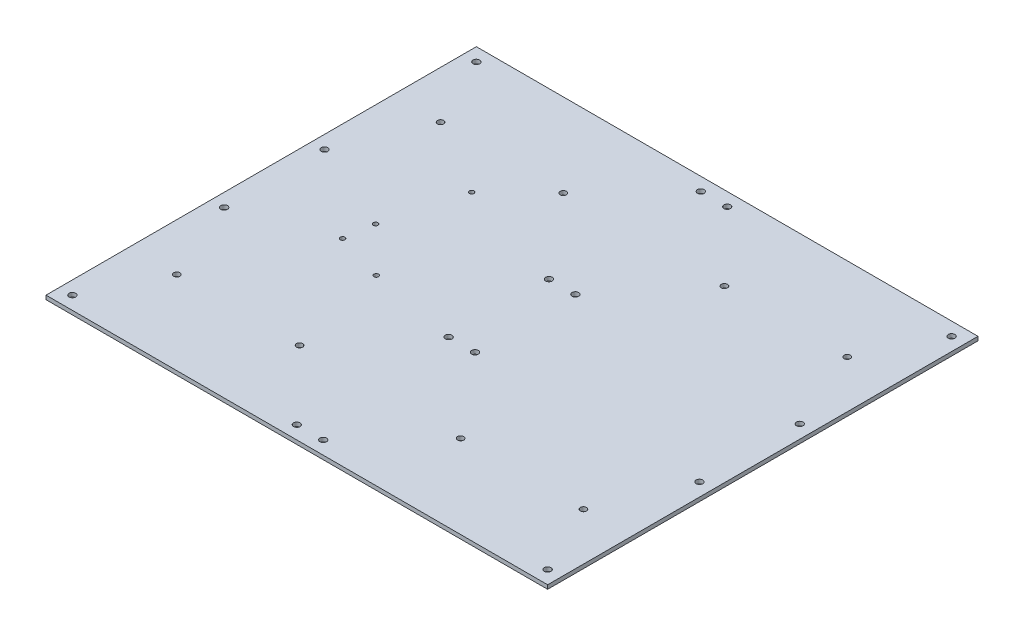
from build123d import *

# Parameters (mm, degrees)
SKIZZE1_W                       = 380
SKIZZE1_H                       = 326
AUFSATZ_LINEAR_AUSTRAGEN1_DEPTH = 3
SKIZZE2_R                       = 2.5
SCHNITT_LINEAR_AUSTRAGEN1_DEPTH = 251.355746888
SKIZZE3_R                       = 2.35
SCHNITT_LINEAR_AUSTRAGEN2_DEPTH = 251.355746888
SKIZZE4_R                       = 1.75
SCHNITT_LINEAR_AUSTRAGEN3_DEPTH = 251.355746888


with BuildPart() as part:
    # Skizze1 → Aufsatz-Linear austragen1 (new body)
    with BuildSketch(Plane(origin=(0, 0, 0), x_dir=(1, 0, 0), z_dir=(0, 1, 0))):
        Rectangle(SKIZZE1_W, SKIZZE1_H)
    extrude(amount=AUFSATZ_LINEAR_AUSTRAGEN1_DEPTH)

    # Skizze2 → Schnitt-Linear austragen1 (cut, through all)
    with BuildSketch(Plane(origin=(0, 3, 0), x_dir=(1, 0, 0), z_dir=(0, 1, 0))):
        with Locations(Location((-180, 153, 0), (0, 0, 270))):
            Circle(SKIZZE2_R)
        with Locations(Location((180, 153, 0), (0, 0, 270))):
            Circle(SKIZZE2_R)
        with Locations(Location((-180, -153, 0), (0, 0, 270))):
            Circle(SKIZZE2_R)
        with Locations(Location((180, -153, 0), (0, 0, 270))):
            Circle(SKIZZE2_R)
        with Locations(Location((-10, 153, 0), (0, 0, 270))):
            Circle(SKIZZE2_R)
        with Locations(Location((10, 153, 0), (0, 0, 270))):
            Circle(SKIZZE2_R)
        with Locations(Location((-10, 38, 0), (0, 0, 270))):
            Circle(SKIZZE2_R)
        with Locations(Location((10, 38, 0), (0, 0, 270))):
            Circle(SKIZZE2_R)
        with Locations(Location((-10, -38, 0), (0, 0, 270))):
            Circle(SKIZZE2_R)
        with Locations(Location((10, -38, 0), (0, 0, 270))):
            Circle(SKIZZE2_R)
        with Locations(Location((-10, -153, 0), (0, 0, 270))):
            Circle(SKIZZE2_R)
        with Locations(Location((10, -153, 0), (0, 0, 270))):
            Circle(SKIZZE2_R)
        with Locations(Location((-180, 38, 0), (0, 0, 270))):
            Circle(SKIZZE2_R)
        with Locations(Location((-180, -38, 0), (0, 0, 270))):
            Circle(SKIZZE2_R)
        with Locations(Location((180, 38, 0), (0, 0, 270))):
            Circle(SKIZZE2_R)
        with Locations(Location((180, -38, 0), (0, 0, 270))):
            Circle(SKIZZE2_R)
    extrude(amount=-SCHNITT_LINEAR_AUSTRAGEN1_DEPTH, mode=Mode.SUBTRACT)

    # Skizze3 → Schnitt-Linear austragen2 (cut, through all)
    with BuildSketch(Plane(origin=(0, 3, 0), x_dir=(1, 0, 0), z_dir=(0, 1, 0))):
        with Locations(Location((61, 99.9, 0), (0, 0, 270))):
            Circle(SKIZZE3_R)
        with Locations(Location((154, 99.9, 0), (0, 0, 270))):
            Circle(SKIZZE3_R)
        with Locations(Location((-154, -99.9, 0), (0, 0, 270))):
            Circle(SKIZZE3_R)
        with Locations(Location((-61, -99.9, 0), (0, 0, 270))):
            Circle(SKIZZE3_R)
        with Locations(Location((154, -99.9, 0), (0, 0, 270))):
            Circle(SKIZZE3_R)
        with Locations(Location((61, -99.9, 0), (0, 0, 270))):
            Circle(SKIZZE3_R)
        with Locations(Location((-154, 99.9, 0), (0, 0, 270))):
            Circle(SKIZZE3_R)
        with Locations(Location((-61, 99.9, 0), (0, 0, 270))):
            Circle(SKIZZE3_R)
    extrude(amount=-SCHNITT_LINEAR_AUSTRAGEN2_DEPTH, mode=Mode.SUBTRACT)

    # Skizze4 → Schnitt-Linear austragen3 (cut, through all)
    with BuildSketch(Plane(origin=(0, 3, 0), x_dir=(1, 0, 0), z_dir=(0, 1, 0))):
        with Locations(Location((-114.839047255, -13.5, 0), (0, 0, 270))):
            Circle(SKIZZE4_R)
        with Locations(Location((-77.839047255, -25, 0), (0, 0, 270))):
            Circle(SKIZZE4_R)
        with Locations(Location((-111.839047255, 8.5, 0), (0, 0, 270))):
            Circle(SKIZZE4_R)
        with Locations(Location((-96.339047255, 65.75, 0), (0, 0, 270))):
            Circle(SKIZZE4_R)
    extrude(amount=-SCHNITT_LINEAR_AUSTRAGEN3_DEPTH, mode=Mode.SUBTRACT)


solid = part.part
